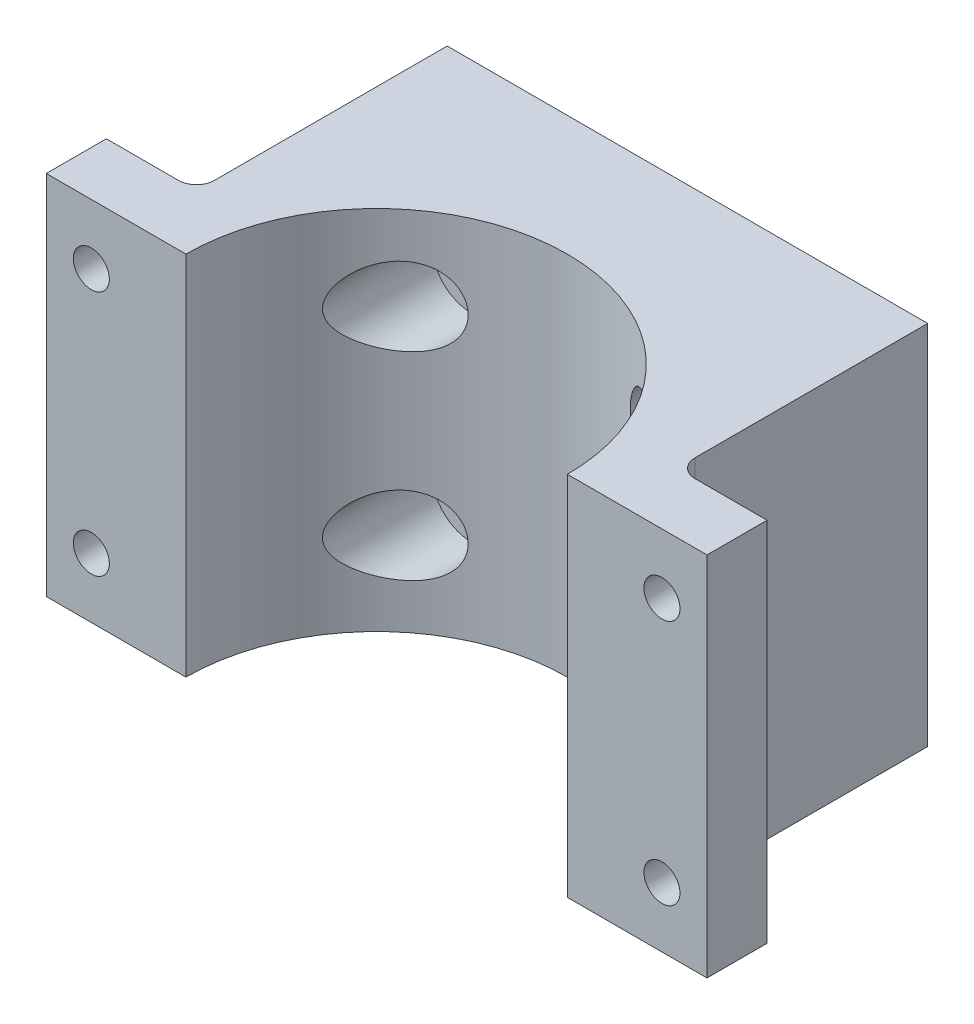
from build123d import *

# Parameters (mm, degrees)
BOSS_EXTRUDE1_DEPTH = 61
SKETCH2_R           = 3
CUT_EXTRUDE1_DEPTH  = 93.136108557
SKETCH3_R           = 4
CUT_EXTRUDE2_DEPTH  = 98.077610704
CUT_EXTRUDE3_START  = -16
SKETCH3_4_R         = 6.5
SKETCH3_4_R_2       = 4
CUT_EXTRUDE3_DEPTH  = 61
FILLET1_R           = 3


with BuildPart() as part:
    # Sketch1 → Boss-Extrude1 (new body)
    with BuildSketch(Plane(origin=(0, 0, 0), x_dir=(1, 0, 0), z_dir=(0, 1, 0))):
        with BuildLine():
            Line((40, 0), (0, 0))
            Line((0, 0), (-40, 0))
            Line((-40, 0), (-40, -20))
            Line((-40, -20), (-40, -41.75))
            Line((-40, -41.75), (-55, -41.75))
            Line((-55, -41.75), (-55, -51.75))
            Line((-55, -51.75), (-40, -51.75))
            Line((-40, -51.75), (-31.75, -51.75))
            ThreePointArc((-31.75, -51.75), (0, -20), (31.75, -51.75))
            Line((31.75, -51.75), (40, -51.75))
            Line((40, -51.75), (55, -51.75))
            Line((55, -51.75), (55, -41.75))
            Line((55, -41.75), (40, -41.75))
            Line((40, -41.75), (40, -20))
            Line((40, -20), (40, 0))
        make_face()
    extrude(amount=BOSS_EXTRUDE1_DEPTH)

    # Sketch2 → Cut-Extrude1 (cut, through all)
    with BuildSketch(Plane(origin=(0, 0, 41.75), x_dir=(-1, 0, 0), z_dir=(0, 0, -1))):
        with Locations((-47.5, 51)):
            Circle(SKETCH2_R)
        with Locations((-47.5, 10)):
            Circle(SKETCH2_R)
        with Locations((47.5, 10)):
            Circle(SKETCH2_R)
        with Locations((47.5, 51)):
            Circle(SKETCH2_R)
    extrude(amount=-CUT_EXTRUDE1_DEPTH, mode=Mode.SUBTRACT)

    # Sketch3 → Cut-Extrude2 (cut, through all)
    with BuildSketch(Plane(origin=(0, 0, 0), x_dir=(-1, 0, 0), z_dir=(0, 0, -1))):
        with Locations((-20, 47)):
            Circle(SKETCH3_R)
        with Locations((-20, 14)):
            Circle(SKETCH3_R)
        with Locations((20, 14)):
            Circle(SKETCH3_R)
        with Locations((20, 47)):
            Circle(SKETCH3_R)
    extrude(amount=-CUT_EXTRUDE2_DEPTH, mode=Mode.SUBTRACT)

    # Sketch3<4> → Cut-Extrude3 (cut)
    # profile 1 of 4: a face of its own
    with BuildSketch(Plane(origin=(0, 0, 0), x_dir=(-1, 0, 0), z_dir=(0, 0, -1)).offset(CUT_EXTRUDE3_START)):
        with Locations((-20, 47)):
            Circle(SKETCH3_4_R)
        with Locations((-20, 47)):
            Circle(SKETCH3_4_R_2, mode=Mode.SUBTRACT)
    # profile 2 of 4: a face of its own
    with BuildSketch(Plane(origin=(0, 0, 0), x_dir=(-1, 0, 0), z_dir=(0, 0, -1)).offset(CUT_EXTRUDE3_START)):
        with Locations((-20, 14)):
            Circle(SKETCH3_4_R)
        with Locations((-20, 14)):
            Circle(SKETCH3_4_R_2, mode=Mode.SUBTRACT)
    # profile 3 of 4: a face of its own
    with BuildSketch(Plane(origin=(0, 0, 0), x_dir=(-1, 0, 0), z_dir=(0, 0, -1)).offset(CUT_EXTRUDE3_START)):
        with Locations((20, 14)):
            Circle(SKETCH3_4_R)
        with Locations((20, 14)):
            Circle(SKETCH3_4_R_2, mode=Mode.SUBTRACT)
    # profile 4 of 4: a face of its own
    with BuildSketch(Plane(origin=(0, 0, 0), x_dir=(-1, 0, 0), z_dir=(0, 0, -1)).offset(CUT_EXTRUDE3_START)):
        with Locations((20, 47)):
            Circle(SKETCH3_4_R)
        with Locations((20, 47)):
            Circle(SKETCH3_4_R_2, mode=Mode.SUBTRACT)
    extrude(amount=-CUT_EXTRUDE3_DEPTH, mode=Mode.SUBTRACT)

    # Fillet1
    fillet1_edges = [part.edges().sort_by_distance(p)[0] for p in [
        (40, 30.5, 41.75),
        (-40, 30.5, 41.75),
    ]]
    fillet(fillet1_edges, radius=FILLET1_R)


solid = part.part
